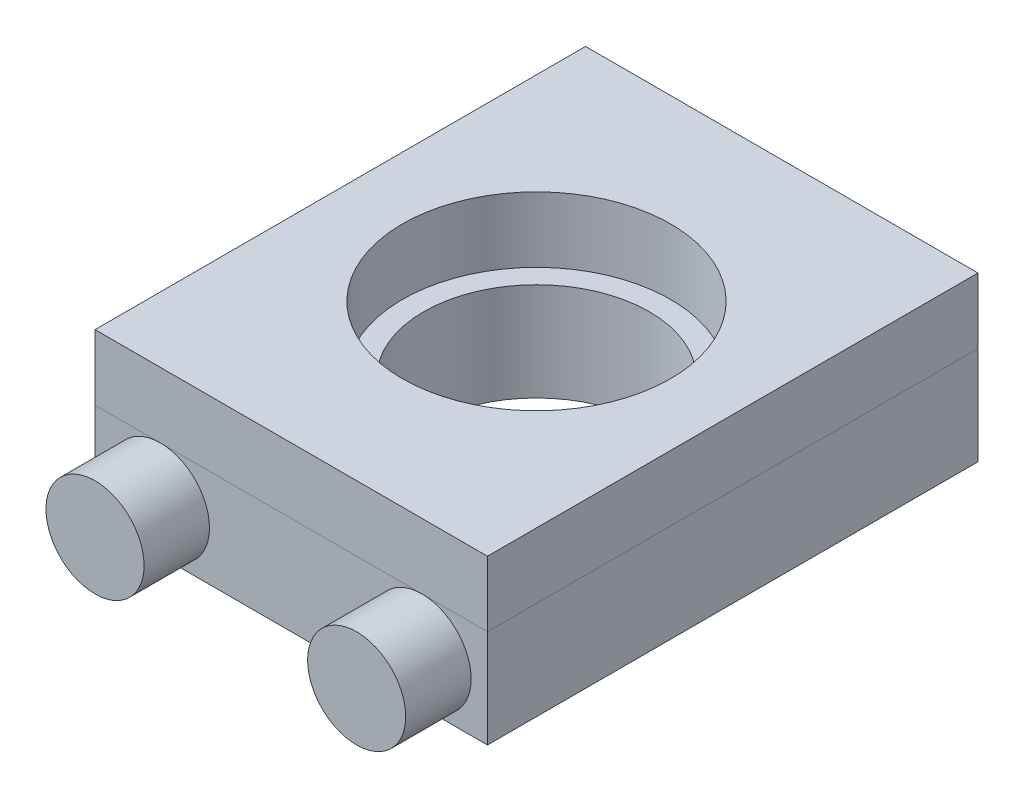
from build123d import *

# Parameters (mm, degrees)
SKETCH_1_W      = 12
SKETCH_1_H      = 15
SKETCH_1_R      = 3.45
EXTRUDE_1_DEPTH = 3
SKETCH_3_W      = 12
SKETCH_3_H      = 15
SKETCH_3_R      = 4.1
EXTRUDE_2_DEPTH = 2
SKETCH_7_R      = 1.5
EXTRUDE_3_DEPTH = 2


with BuildPart() as part:
    # 草图1 → 凸台-拉伸1 (new body)
    with BuildSketch(Plane(origin=(0, 0, 0), x_dir=(1, 0, 0), z_dir=(0, 1, 0))):
        with Locations((6, 7.5)):
            Rectangle(SKETCH_1_W, SKETCH_1_H)
        with Locations(Location((6, 7.5, 0), (0, 0, 270))):
            Circle(SKETCH_1_R, mode=Mode.SUBTRACT)
    extrude(amount=EXTRUDE_1_DEPTH)

    # 草图7 → 凸台-拉伸3 (add)
    with BuildSketch(Plane.XY):
        with Locations(Location((2, 1.5, 0), (0, 0, 270))):
            Circle(SKETCH_7_R)
        with Locations(Location((10, 1.5, 0), (0, 0, 180))):
            Circle(SKETCH_7_R)
    extrude(amount=EXTRUDE_3_DEPTH)


with BuildPart() as body_2:
    # 草图3 → 凸台-拉伸2 (new body)
    with BuildSketch(Plane(origin=(0, 3, 0), x_dir=(1, 0, 0), z_dir=(0, 1, 0))):
        with Locations((6, 7.5)):
            Rectangle(SKETCH_3_W, SKETCH_3_H)
        with Locations(Location((6, 7.5, 0), (0, 0, 270))):
            Circle(SKETCH_3_R, mode=Mode.SUBTRACT)
    extrude(amount=EXTRUDE_2_DEPTH)


solid = Compound([part.part, body_2.part])
